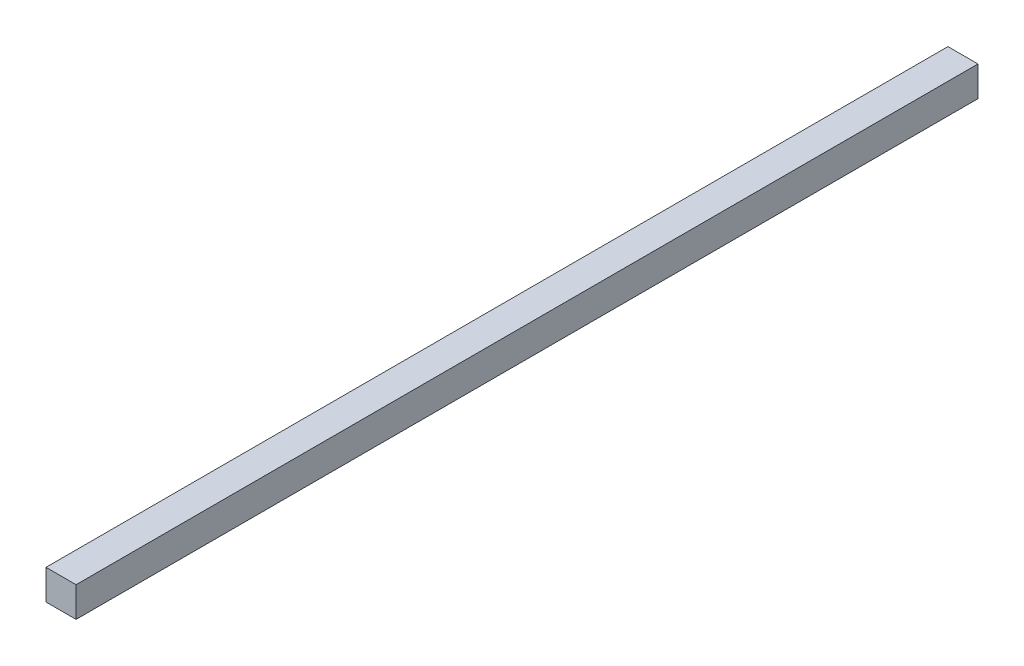
from build123d import *

# Parameters (mm, degrees)
ESQUISSE1_W        = 30
ESQUISSE1_H        = 30
BOSS_EXTRU_1_DEPTH = 900


with BuildPart() as part:
    # Esquisse1 → Boss.-Extru.1 (new body)
    with BuildSketch(Plane.XY):
        Rectangle(ESQUISSE1_W, ESQUISSE1_H)
    extrude(amount=BOSS_EXTRU_1_DEPTH)


solid = part.part
